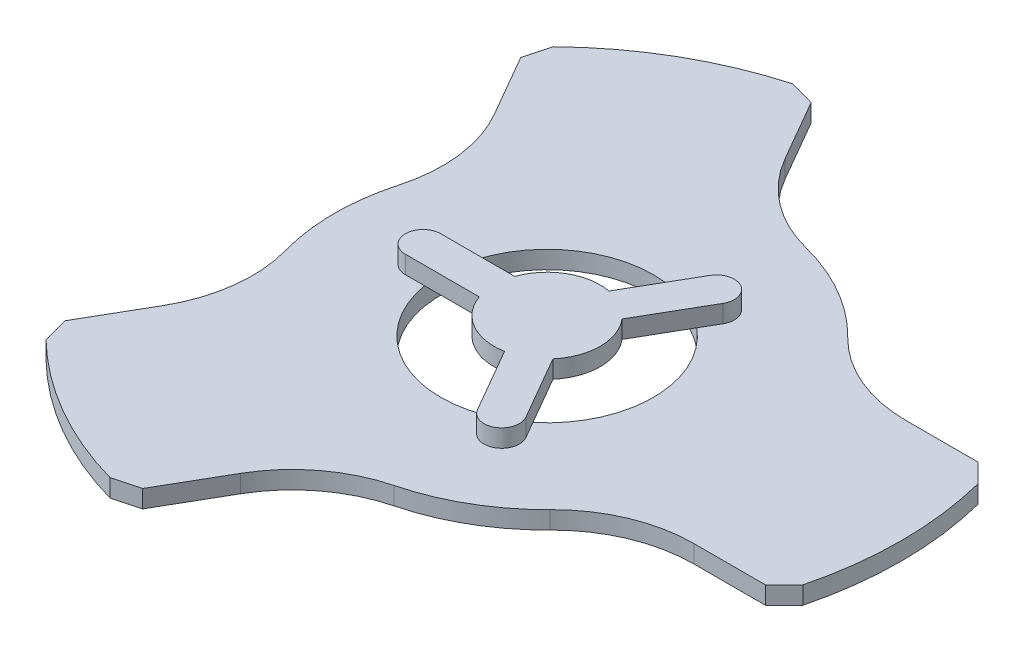
from build123d import *

# Parameters (mm, degrees)
SKETCH2_R           = 60
BOSS_EXTRUDE1_DEPTH = 10
BOSS_EXTRUDE2_DEPTH = 10
CIRPATTERN1_COUNT   = 3
FILLET1_R           = 80
BOSS_EXTRUDE3_DEPTH = 10


with BuildPart() as part:
    # Sketch2 → Boss-Extrude1 (new body)
    with BuildSketch(Plane(origin=(0, 0, 0), x_dir=(1, 0, 0), z_dir=(0, 1, 0))):
        with BuildLine():
            ThreePointArc((120, 0), (115.911099155, 31.058285412), (103.923048454, 60))
            ThreePointArc((103.923048454, 60), (-120, 0), (103.923048454, -60))
            ThreePointArc((103.923048454, -60), (115.911099155, -31.058285412), (120, 0))
        make_face()
        Circle(SKETCH2_R, mode=Mode.SUBTRACT)
    extrude(amount=BOSS_EXTRUDE1_DEPTH)

    # Sketch2<3> → Boss-Extrude2 (add)
    with BuildSketch(Plane(origin=(0, 0, 0), x_dir=(1, 0, 0), z_dir=(0, 1, 0))):
        with BuildLine():
            Line((183.198176877, 60), (103.923048454, 60))
            ThreePointArc((103.923048454, 60), (115.911099155, 31.058285412), (120, 0))
            ThreePointArc((120, 0), (115.911099155, -31.058285412), (103.923048454, -60))
            Line((103.923048454, -60), (183.198176877, -60))
            Line((183.198176877, -60), (193.804778595, -49.393398282))
            ThreePointArc((193.804778595, -49.393398282), (200, 0), (193.804778595, 49.393398282))
            Line((193.804778595, 49.393398282), (183.198176877, 60))
        make_face()
    boss_extrude2 = extrude(amount=BOSS_EXTRUDE2_DEPTH)

    # CirPattern1: Boss-Extrude2 ×3 about axis
    cirpattern1_axis = Axis((0, 10, 0), (0, -1, 0))
    for i in range(1, CIRPATTERN1_COUNT):
        add(boss_extrude2.rotate(cirpattern1_axis, i * 360 / CIRPATTERN1_COUNT))

    # Fillet1
    fillet1_edges = [part.edges().sort_by_distance(p)[0] for p in [
        (-103.923048454, 5, 60),
        (-103.923048454, 5, -60),
        (0, 5, -120),
        (103.923048454, 5, -60),
        (0, 5, 120),
        (103.923048454, 5, 60),
    ]]
    fillet(fillet1_edges, radius=FILLET1_R)

    # Sketch3 → Boss-Extrude3 (add)
    with BuildSketch(Plane(origin=(0, 10, 0), x_dir=(1, 0, 0), z_dir=(0, 1, 0))):
        with BuildLine():
            Line((22.802389662, 19.494897428), (43.660254038, 55.621778265))
            ThreePointArc((43.660254038, 55.621778265), (40, 69.282032303), (26.339745962, 65.621778265))
            Line((26.339745962, 65.621778265), (5.481881586, 29.494897428))
            ThreePointArc((5.481881586, 29.494897428), (-15, 25.980762114), (-28.284271247, 10))
            Line((-28.284271247, 10), (-70, 10))
            ThreePointArc((-70, 10), (-80, 0), (-70, -10))
            Line((-70, -10), (-28.284271247, -10))
            ThreePointArc((-28.284271247, -10), (-15, -25.980762114), (5.481881586, -29.494897428))
            Line((5.481881586, -29.494897428), (26.339745962, -65.621778265))
            ThreePointArc((26.339745962, -65.621778265), (40, -69.282032303), (43.660254038, -55.621778265))
            Line((43.660254038, -55.621778265), (22.802389662, -19.494897428))
            ThreePointArc((22.802389662, -19.494897428), (30, 0), (22.802389662, 19.494897428))
        make_face()
    extrude(amount=BOSS_EXTRUDE3_DEPTH)


solid = part.part
